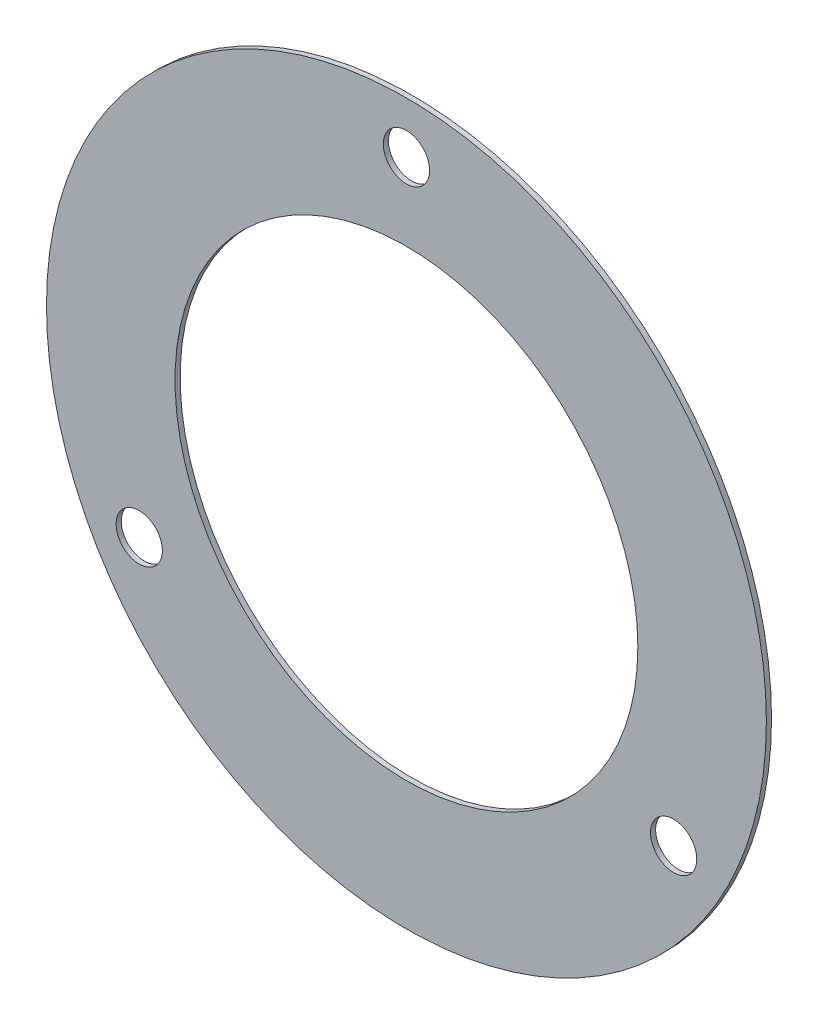
from build123d import *

# Parameters (mm, degrees)
SCHIZZO1_R                   = 70
SCHIZZO1_R_2                 = 45
SCHIZZO1_R_3                 = 4.5
ESTRUSIONE_ESTRUSIONE1_DEPTH = 1


with BuildPart() as part:
    # Schizzo1 → Estrusione-Estrusione1 (new body)
    with BuildSketch(Plane.XY):
        Circle(SCHIZZO1_R)
        Circle(SCHIZZO1_R_2, mode=Mode.SUBTRACT)
        with Locations((0, 60)):
            Circle(SCHIZZO1_R_3, mode=Mode.SUBTRACT)
        with Locations((51.961524227, -30)):
            Circle(SCHIZZO1_R_3, mode=Mode.SUBTRACT)
        with Locations((-51.961524227, -30)):
            Circle(SCHIZZO1_R_3, mode=Mode.SUBTRACT)
    extrude(amount=ESTRUSIONE_ESTRUSIONE1_DEPTH)


solid = part.part
